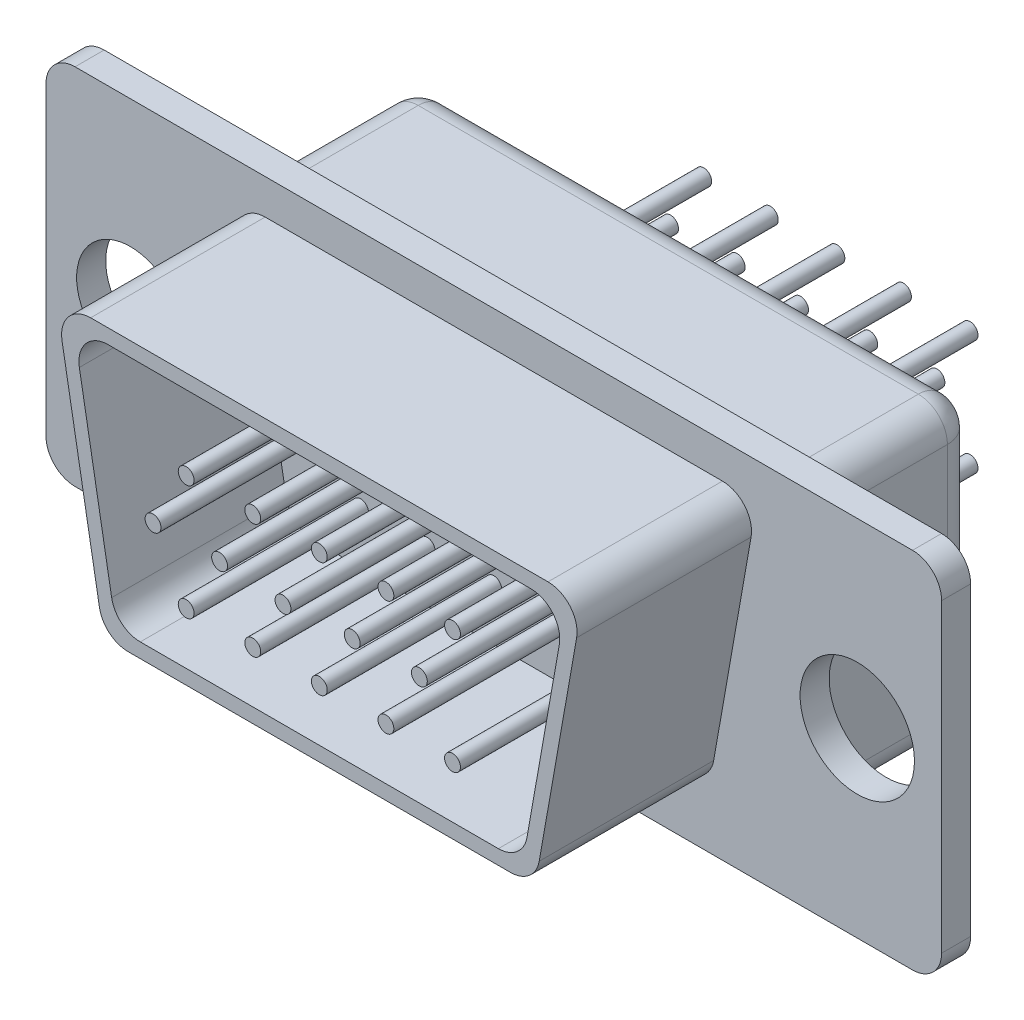
from build123d import *

# Parameters (mm, degrees)
ESQUISSE1_W      = 30.8
ESQUISSE1_H      = 12.5
ESQUISSE1_R      = 1.847277142
ESQUISSE1_R_2    = 1.96687405
EXTRUSION1_DEPTH = 1
EXTRUSION2_DEPTH = 6
ESQUISSE3_W      = 19.2
ESQUISSE3_H      = 10
EXTRUSION3_DEPTH = 6
ESQUISSE4_R      = 0.272537765
EXTRUSION4_DEPTH = 4.8
CONG_1_R         = 1
EXTRUSION6_START = 6
ESQUISSE7_R      = 0.272537765
EXTRUSION6_DEPTH = 6


with BuildPart() as part:
    # Esquisse1 → Extrusion1 (new body)
    with BuildSketch(Plane.XY):
        with Locations((15.4, 6.25)):
            Rectangle(ESQUISSE1_W, ESQUISSE1_H)
        with Locations((2.9, 6.25)):
            Circle(ESQUISSE1_R, mode=Mode.SUBTRACT)
        with Locations((27.9, 6.25)):
            Circle(ESQUISSE1_R_2, mode=Mode.SUBTRACT)
    extrude(amount=EXTRUSION1_DEPTH)

    # Esquisse2 → Extrusion2 (add)
    with BuildSketch(Plane.XY.offset(1)):
        with BuildLine():
            Line((7.535876796, 11.292947196), (23.264123204, 11.292947196))
            ThreePointArc((23.264123204, 11.292947196), (24.030167647, 10.935734805), (24.248930957, 10.119299018))
            Line((24.248930957, 10.119299018), (22.961743998, 2.819299018))
            ThreePointArc((22.961743998, 2.819299018), (22.619723854, 2.226902752), (21.976936245, 1.992947196))
            Line((21.976936245, 1.992947196), (8.823063755, 1.992947196))
            ThreePointArc((8.823063755, 1.992947196), (8.180276146, 2.226902752), (7.838256002, 2.819299018))
            Line((7.838256002, 2.819299018), (6.551069043, 10.119299018))
            ThreePointArc((6.551069043, 10.119299018), (6.769832353, 10.935734805), (7.535876796, 11.292947196))
        make_face()
        with BuildLine():
            Line((8.131753593, 10.792947196), (22.668246407, 10.792947196))
            ThreePointArc((22.668246407, 10.792947196), (23.434290851, 10.435734805), (23.65305416, 9.619299018))
            Line((23.65305416, 9.619299018), (22.542194182, 3.319299018))
            ThreePointArc((22.542194182, 3.319299018), (22.200174039, 2.726902752), (21.557386429, 2.492947196))
            Line((21.557386429, 2.492947196), (9.242613571, 2.492947196))
            ThreePointArc((9.242613571, 2.492947196), (8.599825961, 2.726902752), (8.257805818, 3.319299018))
            Line((8.257805818, 3.319299018), (7.14694584, 9.619299018))
            ThreePointArc((7.14694584, 9.619299018), (7.365709149, 10.435734805), (8.131753593, 10.792947196))
        make_face(mode=Mode.SUBTRACT)
    extrude(amount=EXTRUSION2_DEPTH)

    # Esquisse3 → Extrusion3 (add)
    with BuildSketch(Plane(origin=(0, 0, 0), x_dir=(-1, 0, 0), z_dir=(0, 0, -1))):
        with Locations((-15.4, 6.25)):
            Rectangle(ESQUISSE3_W, ESQUISSE3_H)
    extrude(amount=EXTRUSION3_DEPTH)

    # Esquisse4 → Extrusion4 (add)
    with BuildSketch(Plane(origin=(0, 0, -6), x_dir=(-1, 0, 0), z_dir=(0, 0, -1))):
        with Locations((-19.98, 8.23)):
            Circle(ESQUISSE4_R)
        with Locations((-17.69, 8.23)):
            Circle(ESQUISSE4_R)
        with Locations((-15.4, 8.23)):
            Circle(ESQUISSE4_R)
        with Locations((-13.11, 8.23)):
            Circle(ESQUISSE4_R)
        with Locations((-10.82, 8.23)):
            Circle(ESQUISSE4_R)
        with Locations((-9.68, 6.25)):
            Circle(ESQUISSE4_R)
        with Locations((-11.97, 6.25)):
            Circle(ESQUISSE4_R)
        with Locations((-14.149725584, 6.068095869)):
            Circle(ESQUISSE4_R)
        with Locations((-16.529732269, 6.22882427)):
            Circle(ESQUISSE4_R)
        with Locations((-18.84, 6.25)):
            Circle(ESQUISSE4_R)
        with Locations((-19.98, 4.27)):
            Circle(ESQUISSE4_R)
        with Locations((-17.69, 4.27)):
            Circle(ESQUISSE4_R)
        with Locations((-15.4, 4.27)):
            Circle(ESQUISSE4_R)
        with Locations((-13.11, 4.27)):
            Circle(ESQUISSE4_R)
        with Locations((-10.82, 4.27)):
            Circle(ESQUISSE4_R)
    extrude(amount=EXTRUSION4_DEPTH)

    # Congé1
    cong_1_edges = [part.edges().sort_by_distance(p)[0] for p in [
        (25, 11.25, -3),
        (25, 1.25, -3),
        (5.8, 1.25, -3),
        (5.8, 11.25, -3),
        (25, 6.25, -6),
        (15.4, 1.25, -6),
        (5.8, 6.25, -6),
        (15.4, 11.25, -6),
        (0, 12.5, 0.5),
        (30.8, 12.5, 0.5),
        (30.8, 0, 0.5),
        (0, 0, 0.5),
    ]]
    fillet(cong_1_edges, radius=CONG_1_R)

    # Esquisse7 → Extrusion6 (add)
    with BuildSketch(Plane.XY.offset(1).offset(EXTRUSION6_START)):
        with Locations(Location((19.98, 8.23, 0), (0, 0, 180))):
            Circle(ESQUISSE7_R)
        with Locations(Location((17.69, 8.23, 0), (0, 0, 180))):
            Circle(ESQUISSE7_R)
        with Locations(Location((15.4, 8.23, 0), (0, 0, 180))):
            Circle(ESQUISSE7_R)
        with Locations(Location((13.11, 8.23, 0), (0, 0, 180))):
            Circle(ESQUISSE7_R)
        with Locations(Location((10.82, 8.23, 0), (0, 0, 180))):
            Circle(ESQUISSE7_R)
        with Locations(Location((9.68, 6.25, 0), (0, 0, 180))):
            Circle(ESQUISSE7_R)
        with Locations(Location((11.97, 6.25, 0), (0, 0, 180))):
            Circle(ESQUISSE7_R)
        with Locations(Location((14.149725584, 6.068095869, 0), (0, 0, 180))):
            Circle(ESQUISSE7_R)
        with Locations(Location((16.529732269, 6.22882427, 0), (0, 0, 180))):
            Circle(ESQUISSE7_R)
        with Locations(Location((18.84, 6.25, 0), (0, 0, 180))):
            Circle(ESQUISSE7_R)
        with Locations(Location((19.98, 4.27, 0), (0, 0, 180))):
            Circle(ESQUISSE7_R)
        with Locations(Location((17.69, 4.27, 0), (0, 0, 180))):
            Circle(ESQUISSE7_R)
        with Locations(Location((15.4, 4.27, 0), (0, 0, 180))):
            Circle(ESQUISSE7_R)
        with Locations(Location((13.11, 4.27, 0), (0, 0, 180))):
            Circle(ESQUISSE7_R)
        with Locations(Location((10.82, 4.27, 0), (0, 0, 180))):
            Circle(ESQUISSE7_R)
    extrude(amount=-EXTRUSION6_DEPTH)


solid = part.part
